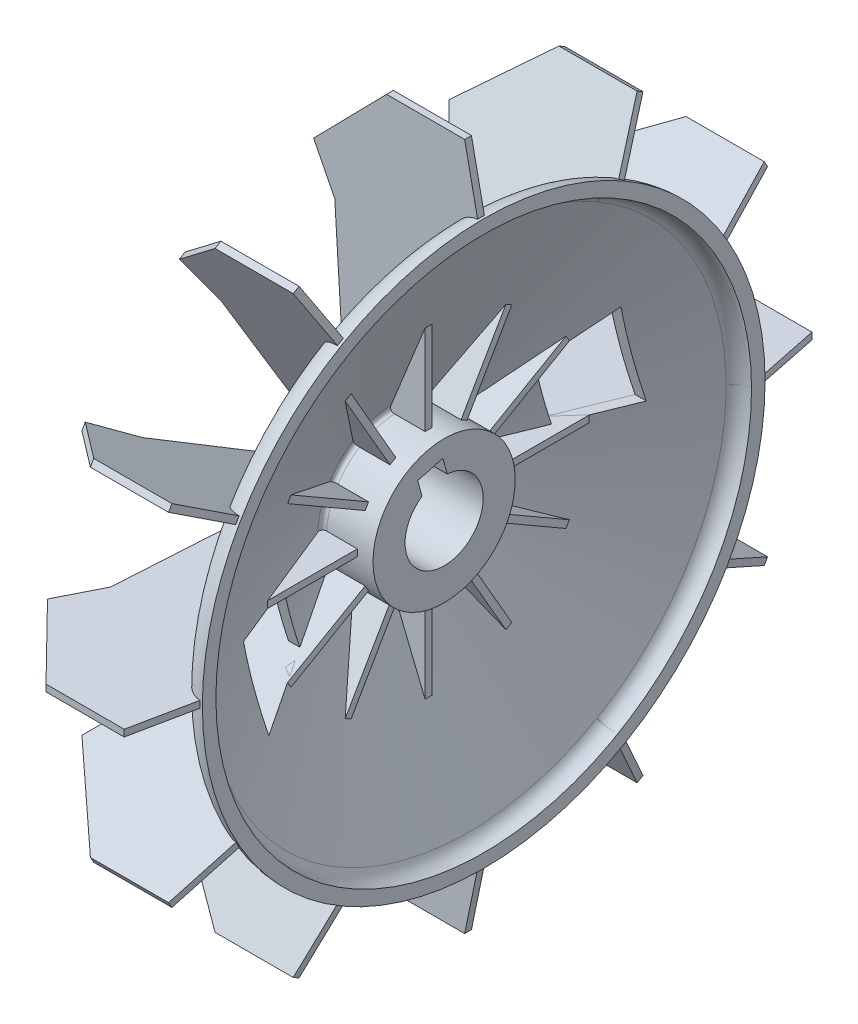
from build123d import *

# Parameters (mm, degrees)
EXTRUSION4_DEPTH             = 0.65
EXTRUSION4_DEPTH_BACK        = 0.65
R_P_TITION_CIRCULAIRE4_COUNT = 12
ENL_V_MAT_EXTRU_1_DEPTH      = 99.671171068


with BuildPart() as part:
    # Esquisse1 → Révolution1 (revolve)
    with BuildSketch(Plane.XY):
        with BuildLine():
            Line((0, 7.5), (0, 13.65))
            Line((0, 13.65), (6.158482182, 13.65))
            ThreePointArc((6.158482182, 13.65), (7.554460976, 14.076056122), (8.47462752, 15.209005433))
            Line((8.47462752, 15.209005433), (22.967709325, 50.881989134))
            ThreePointArc((22.967709325, 50.881989134), (24.808042413, 53.147887756), (27.6, 54))
            Line((27.6, 54), (27.6, 51.4))
            ThreePointArc((27.6, 51.4), (25.785875596, 50.963366978), (24.580761982, 49.538797947))
            Line((24.580761982, 49.538797947), (10.419398188, 14.68229837))
            ThreePointArc((10.419398188, 14.68229837), (10.492058626, 13.981206362), (11.114241789, 13.65))
            Line((11.114241789, 13.65), (20, 13.65))
            Line((20, 13.65), (20, 7.5))
            Line((20, 7.5), (0, 7.5))
        make_face()
    revolve(axis=Axis((-19.731638418, 0, 0), (1, 0, 0)))

    # Esquisse3 → Enlèv. mat.-Extru.1 (cut, through all)
    with BuildSketch(Plane(origin=(27.6, 0, 0), x_dir=(0, 0, -1), z_dir=(1, 0, 0))):
        Polygon((-5.054768826, 9.205395815), (-0.225139694, 10.499491041), (0.584687547, 7.477174632), (-4.244941585, 6.183079406), align=None)
        Polygon((-25.707737535, -0.65), (-22.588553779, -12.290952255), (-33.795747181, -18.761428383), (-38.64868979, -0.65), align=None)
        Polygon((33.795747181, 18.761428383), (38.64868979, 0.65), (25.707737535, 0.65), (22.588553779, 12.290952255), align=None)
    extrude(amount=-ENL_V_MAT_EXTRU_1_DEPTH, mode=Mode.SUBTRACT)


with BuildPart() as body_2:
    # Esquisse2 → Extrusion4 (new, two sides: drawn at the far end of the back side and taken through both)
    with BuildSketch(Plane.XY.offset(-EXTRUSION4_DEPTH_BACK)):
        with BuildLine():
            Line((1.5, 13.65), (-0.337104746, 43.686397091))
            Line((-0.337104746, 43.686397091), (-4.4, 51.717143143))
            Line((-4.4, 51.717143143), (9.6, 66))
            Line((9.6, 66), (24.6, 66))
            Line((24.6, 66), (27.6, 51.4))
            ThreePointArc((27.6, 51.4), (25.785875596, 50.963366978), (24.580761982, 49.538797947))
            Line((24.580761982, 49.538797947), (17, 30.87966097))
            Line((17, 30.87966097), (17, 13.65))
            Line((17, 13.65), (1.5, 13.65))
        make_face()
    extrude(amount=EXTRUSION4_DEPTH + EXTRUSION4_DEPTH_BACK)


with BuildPart() as r_p_tition_circulaire4_1:
    # Répétition circulaire4: pattern copy
    add(body_2.part.rotate(Axis((-19.731638418, 0, 0), (1, 0, 0)), 1 * 360 / R_P_TITION_CIRCULAIRE4_COUNT))


with BuildPart() as r_p_tition_circulaire4_2:
    # Répétition circulaire4: pattern copy
    add(body_2.part.rotate(Axis((-19.731638418, 0, 0), (1, 0, 0)), 2 * 360 / R_P_TITION_CIRCULAIRE4_COUNT))


with BuildPart() as r_p_tition_circulaire4_3:
    # Répétition circulaire4: pattern copy
    add(body_2.part.rotate(Axis((-19.731638418, 0, 0), (1, 0, 0)), 3 * 360 / R_P_TITION_CIRCULAIRE4_COUNT))


with BuildPart() as r_p_tition_circulaire4_4:
    # Répétition circulaire4: pattern copy
    add(body_2.part.rotate(Axis((-19.731638418, 0, 0), (1, 0, 0)), 4 * 360 / R_P_TITION_CIRCULAIRE4_COUNT))


with BuildPart() as r_p_tition_circulaire4_5:
    # Répétition circulaire4: pattern copy
    add(body_2.part.rotate(Axis((-19.731638418, 0, 0), (1, 0, 0)), 5 * 360 / R_P_TITION_CIRCULAIRE4_COUNT))


with BuildPart() as r_p_tition_circulaire4_6:
    # Répétition circulaire4: pattern copy
    add(body_2.part.rotate(Axis((-19.731638418, 0, 0), (1, 0, 0)), 6 * 360 / R_P_TITION_CIRCULAIRE4_COUNT))


with BuildPart() as r_p_tition_circulaire4_7:
    # Répétition circulaire4: pattern copy
    add(body_2.part.rotate(Axis((-19.731638418, 0, 0), (1, 0, 0)), 7 * 360 / R_P_TITION_CIRCULAIRE4_COUNT))


with BuildPart() as r_p_tition_circulaire4_8:
    # Répétition circulaire4: pattern copy
    add(body_2.part.rotate(Axis((-19.731638418, 0, 0), (1, 0, 0)), 8 * 360 / R_P_TITION_CIRCULAIRE4_COUNT))


with BuildPart() as r_p_tition_circulaire4_9:
    # Répétition circulaire4: pattern copy
    add(body_2.part.rotate(Axis((-19.731638418, 0, 0), (1, 0, 0)), 9 * 360 / R_P_TITION_CIRCULAIRE4_COUNT))


with BuildPart() as r_p_tition_circulaire4_10:
    # Répétition circulaire4: pattern copy
    add(body_2.part.rotate(Axis((-19.731638418, 0, 0), (1, 0, 0)), 10 * 360 / R_P_TITION_CIRCULAIRE4_COUNT))


with BuildPart() as r_p_tition_circulaire4_11:
    # Répétition circulaire4: pattern copy
    add(body_2.part.rotate(Axis((-19.731638418, 0, 0), (1, 0, 0)), 11 * 360 / R_P_TITION_CIRCULAIRE4_COUNT))


solid = Compound([part.part, body_2.part, r_p_tition_circulaire4_1.part, r_p_tition_circulaire4_2.part, r_p_tition_circulaire4_3.part, r_p_tition_circulaire4_4.part, r_p_tition_circulaire4_5.part, r_p_tition_circulaire4_6.part, r_p_tition_circulaire4_7.part, r_p_tition_circulaire4_8.part, r_p_tition_circulaire4_9.part, r_p_tition_circulaire4_10.part, r_p_tition_circulaire4_11.part])
